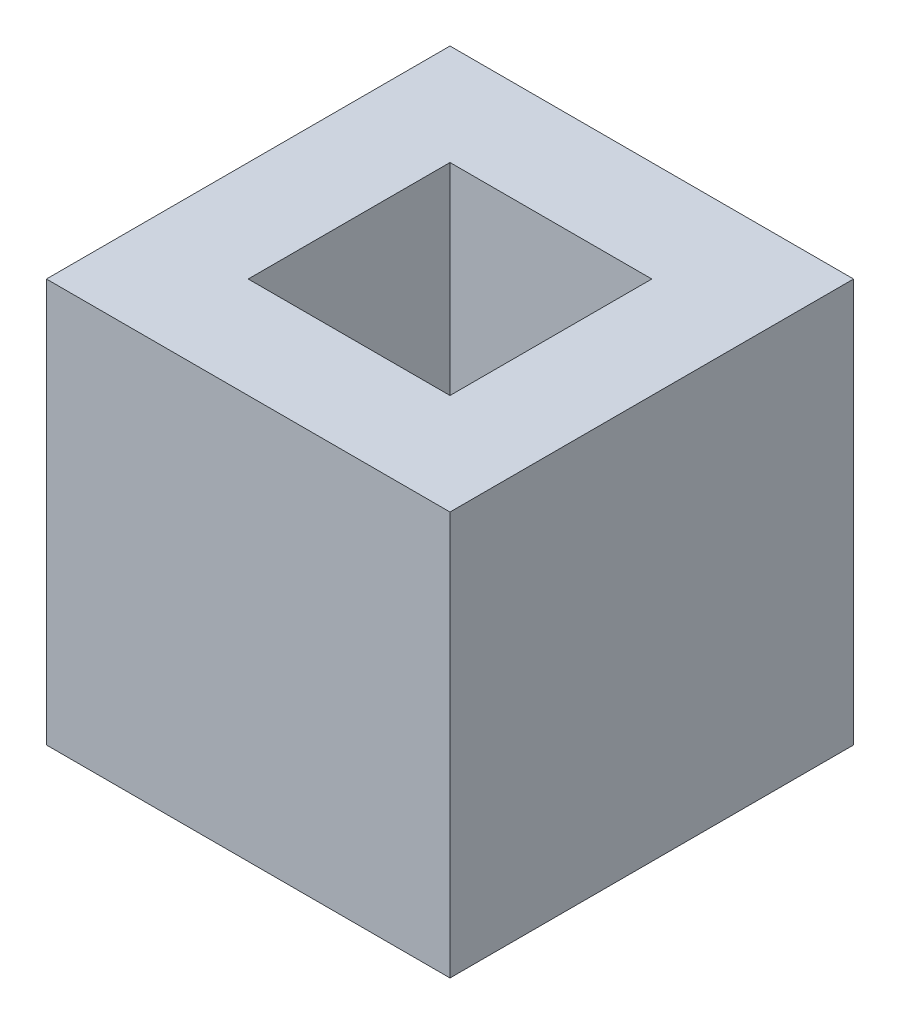
from build123d import *

# Parameters (mm, degrees)
SKETCH1_W           = 10
SKETCH1_H           = 10
SKETCH1_W_2         = 5
SKETCH1_H_2         = 5
BOSS_EXTRUDE1_DEPTH = 10


with BuildPart() as part:
    # Sketch1 → Boss-Extrude1 (new body)
    with BuildSketch(Plane(origin=(0, 0, 0), x_dir=(1, 0, 0), z_dir=(0, 1, 0))):
        Rectangle(SKETCH1_W, SKETCH1_H)
        Rectangle(SKETCH1_W_2, SKETCH1_H_2, mode=Mode.SUBTRACT)
    extrude(amount=BOSS_EXTRUDE1_DEPTH)


solid = part.part
